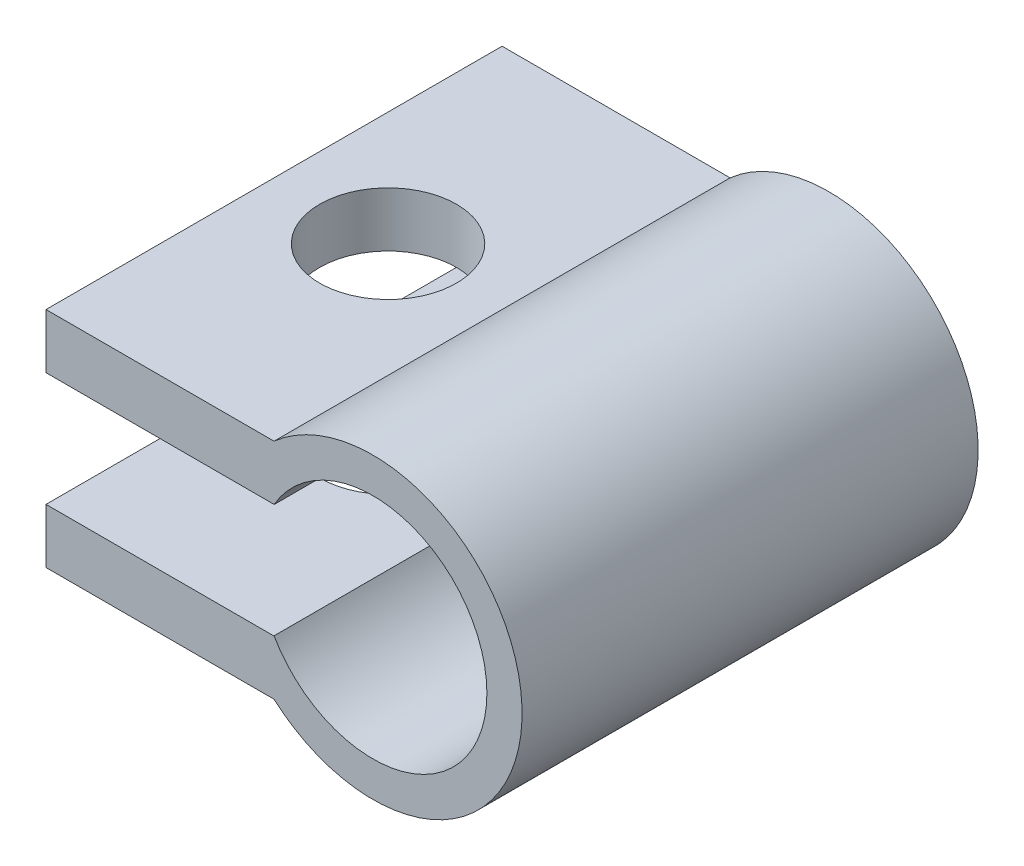
from build123d import *

# Parameters (mm, degrees)
BOSS_EXTRUDE1_DEPTH = 5
SKETCH2_R           = 1.5
CUT_EXTRUDE1_DEPTH  = 10


with BuildPart() as part:
    # Sketch1 → Boss-Extrude1 (new, symmetric)
    with BuildSketch(Plane.XY):
        with BuildLine():
            Line((-7.167342336, 1.25), (-7.167342336, 2.45))
            Line((-7.167342336, 2.45), (-2.167342336, 2.45))
            ThreePointArc((-2.167342336, 2.45), (3.271066004, 0), (-2.167342336, -2.45))
            Line((-2.167342336, -2.45), (-7.167342336, -2.45))
            Line((-7.167342336, -2.45), (-7.167342336, -1.25))
            Line((-7.167342336, -1.25), (-2.167342336, -1.25))
            Line((-2.167342336, -1.25), (-2.167342336, -1.246044622))
            ThreePointArc((-2.167342336, -1.246044622), (2.5, 0), (-2.167342336, 1.246044622))
            Line((-2.167342336, 1.246044622), (-2.167342336, 1.25))
            Line((-2.167342336, 1.25), (-7.167342336, 1.25))
        make_face()
    extrude(amount=BOSS_EXTRUDE1_DEPTH, both=True)

    # Sketch2 → Cut-Extrude1 (cut)
    with BuildSketch(Plane(origin=(0, 2.45, 0), x_dir=(1, 0, 0), z_dir=(0, 1, 0))):
        with Locations(Location((-4.667342336, 0, 0), (0, 0, 180))):
            Circle(SKETCH2_R)
    extrude(amount=-CUT_EXTRUDE1_DEPTH, mode=Mode.SUBTRACT)


solid = part.part
